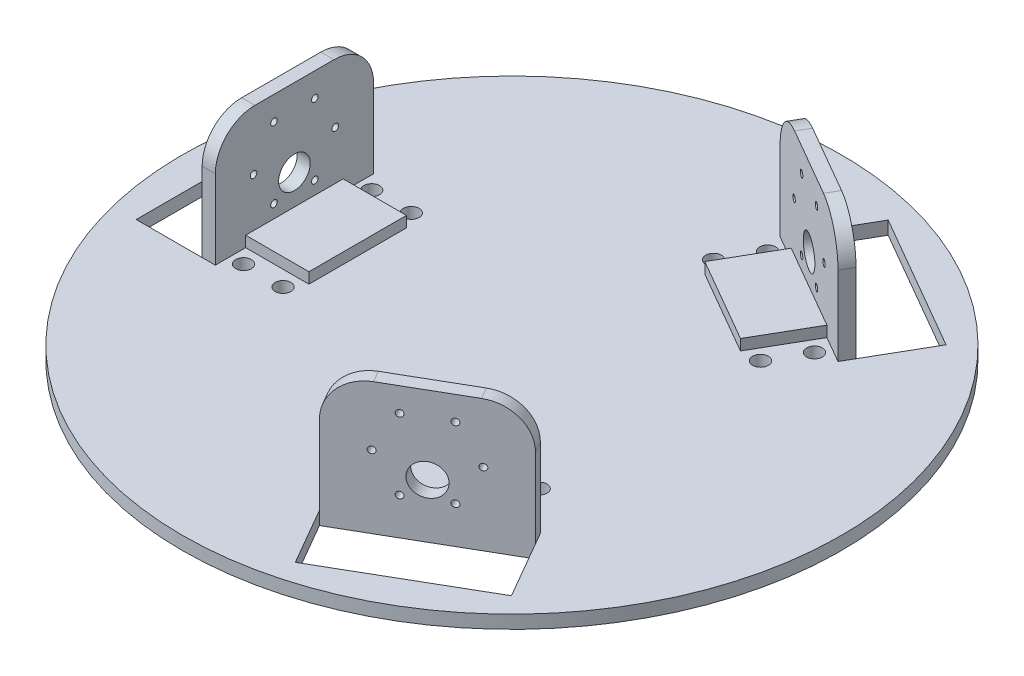
from build123d import *

# Parameters (mm, degrees)
ESQUISSE1_R                  = 125
ESQUISSE1_W                  = 25
ESQUISSE1_H                  = 60
BOSS_EXTRU_1_DEPTH           = 5
ESQUISSE2_W                  = 5
ESQUISSE2_H                  = 30
BOSS_EXTRU_2_DEPTH           = 45
CONG_1_R                     = 15
ESQUISSE3_R                  = 6
ESQUISSE3_R_2                = 1.25
ENL_V_MAT_EXTRU_1_DEPTH      = 50
R_P_TITION_CIRCULAIRE1_COUNT = 3
ESQUISSE7_W                  = 24
ESQUISSE7_H                  = 37
BOSS_EXTRU_4_DEPTH           = 4.1
ESQUISSE8_R                  = 3
ENL_V_MAT_EXTRU_2_DEPTH      = 183.41436347
R_P_TITION_CIRCULAIRE2_COUNT = 3


with BuildPart() as part:
    # Esquisse1 → Boss.-Extru.1 (new body)
    with BuildSketch(Plane(origin=(0, 0, 0), x_dir=(1, 0, 0), z_dir=(0, 1, 0))):
        with Locations(Location((0, 0, 0), (0, 0, 270))):
            Circle(ESQUISSE1_R)
        with Locations((-100, 0)):
            Rectangle(ESQUISSE1_W, ESQUISSE1_H, mode=Mode.SUBTRACT)
        Polygon((82.230762114, 82.427857926), (30.269237886, 112.427857926), (17.769237886, 90.777222831), (69.730762114, 60.777222831), align=None, mode=Mode.SUBTRACT)
        Polygon((30.269237886, -112.427857926), (82.230762114, -82.427857926), (69.730762114, -60.777222831), (17.769237886, -90.777222831), align=None, mode=Mode.SUBTRACT)
    extrude(amount=BOSS_EXTRU_1_DEPTH)

    # Esquisse2 → Boss.-Extru.2 (add)
    with BuildSketch(Plane(origin=(0, 5, 0), x_dir=(1, 0, 0), z_dir=(0, 1, 0))):
        with Locations((-85, -15)):
            Rectangle(ESQUISSE2_W, ESQUISSE2_H)
        with Locations((-85, 15)):
            Rectangle(ESQUISSE2_W, ESQUISSE2_H)
        Polygon((69.730762114, 60.777222831), (67.230762114, 56.447095812), (15.269237886, 86.447095812), (17.769237886, 90.777222831), align=None)
        Polygon((17.769237886, -90.777222831), (15.269237886, -86.447095812), (67.230762114, -56.447095812), (69.730762114, -60.777222831), align=None)
    extrude(amount=BOSS_EXTRU_2_DEPTH)

    # Congé1
    cong_1_edges = [part.edges().sort_by_distance(p)[0] for p in [
        (-85, 50, -30),
        (-85, 50, 30),
        (68.480762114, 50, -58.612159322),
        (16.519237886, 50, -88.612159322),
        (16.519237886, 50, 88.612159322),
        (68.480762114, 50, 58.612159322),
    ]]
    fillet(cong_1_edges, radius=CONG_1_R)

    # Esquisse3 → Enlèv. mat.-Extru.1 (cut)
    with BuildSketch(Plane.ZY.offset(87.5)):
        with Locations((0, 20.5)):
            Circle(ESQUISSE3_R)
        with Locations((-7.75, 14.08)):
            Circle(ESQUISSE3_R_2)
        with Locations((-15.5, 27.5)):
            Circle(ESQUISSE3_R_2)
        with Locations((-7.75, 40.92)):
            Circle(ESQUISSE3_R_2)
        with Locations((7.75, 40.92)):
            Circle(ESQUISSE3_R_2)
        with Locations((15.5, 27.5)):
            Circle(ESQUISSE3_R_2)
        with Locations((7.75, 14.08)):
            Circle(ESQUISSE3_R_2)
    enl_v_mat_extru_1 = extrude(amount=-ENL_V_MAT_EXTRU_1_DEPTH, mode=Mode.SUBTRACT)

    # Répétition circulaire1: Enlèv. mat.-Extru.1 ×3 about axis
    r_p_tition_circulaire1_axis = Axis((0, 5, 0), (0, 1, 0))
    for i in range(1, R_P_TITION_CIRCULAIRE1_COUNT):
        add(enl_v_mat_extru_1.rotate(r_p_tition_circulaire1_axis, i * 360 / R_P_TITION_CIRCULAIRE1_COUNT), mode=Mode.SUBTRACT)

    # Esquisse7 → Boss.-Extru.4 (add)
    with BuildSketch(Plane(origin=(0, 5, 0), x_dir=(1, 0, 0), z_dir=(0, 1, 0))):
        with Locations((-70.5, 0)):
            Rectangle(ESQUISSE7_W, ESQUISSE7_H)
    boss_extru_4 = extrude(amount=BOSS_EXTRU_4_DEPTH)

    # Esquisse8 → Enlèv. mat.-Extru.2 (cut, through all)
    with BuildSketch(Plane(origin=(0, 5, 0), x_dir=(1, 0, 0), z_dir=(0, 1, 0))):
        with Locations(Location((-77.5, 24.303995394, 0), (0, 0, 270))):
            Circle(ESQUISSE8_R)
        with Locations(Location((-62.5, 24.303995394, 0), (0, 0, 270))):
            Circle(ESQUISSE8_R)
        with Locations(Location((-62.5, -24.303995394, 0), (0, 0, 90))):
            Circle(ESQUISSE8_R)
        with Locations(Location((-77.5, -24.303995394, 0), (0, 0, 90))):
            Circle(ESQUISSE8_R)
    enl_v_mat_extru_2 = extrude(amount=-ENL_V_MAT_EXTRU_2_DEPTH, mode=Mode.SUBTRACT)

    # Répétition circulaire2: Boss.-Extru.4, Enlèv. mat.-Extru.2 ×3 about axis
    r_p_tition_circulaire2_axis = Axis((0, 0, 0), (0, 1, 0))
    add([boss_extru_4.rotate(r_p_tition_circulaire2_axis, i * 360 / R_P_TITION_CIRCULAIRE2_COUNT) for i in range(1, R_P_TITION_CIRCULAIRE2_COUNT)])
    add([enl_v_mat_extru_2.rotate(r_p_tition_circulaire2_axis, i * 360 / R_P_TITION_CIRCULAIRE2_COUNT) for i in range(1, R_P_TITION_CIRCULAIRE2_COUNT)], mode=Mode.SUBTRACT)


solid = part.part
